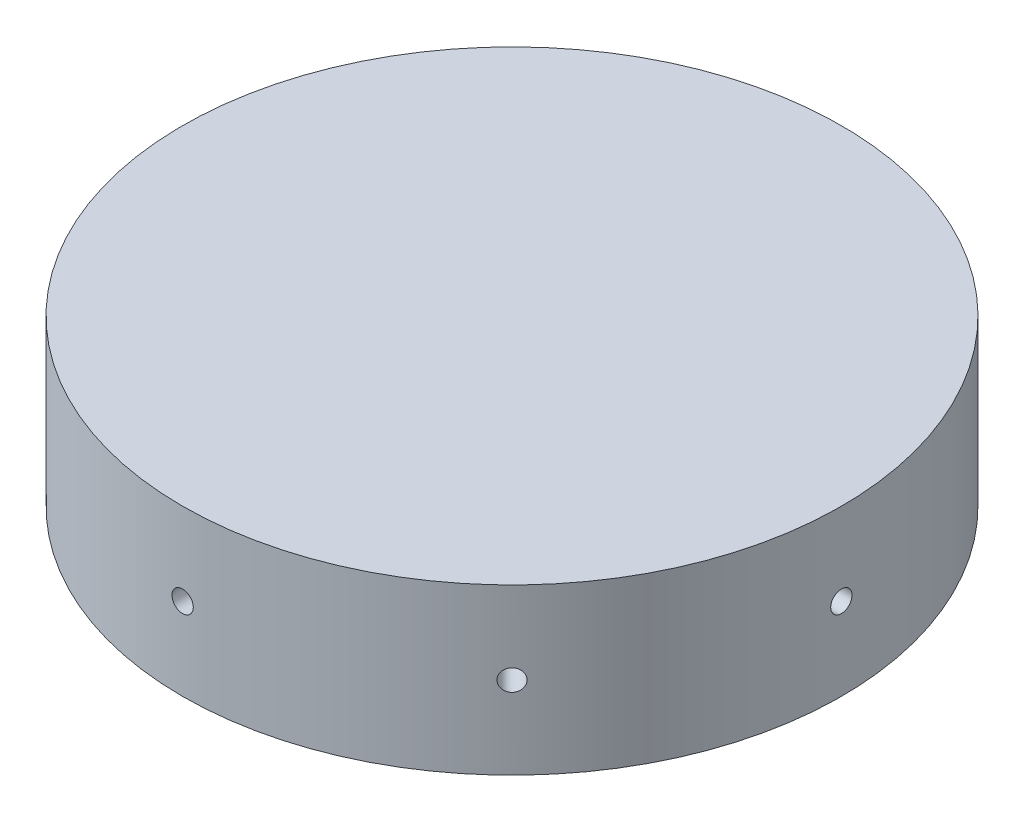
from build123d import *

# Parameters (mm, degrees)
SKETCH1_R                = 50.8
BULKHEAD_EXTRUSION_DEPTH = 25.4
SKETCH2_R                = 1.6383
SCREW_HOLE_DEPTH         = 12.7
CIRPATTERN1_COUNT        = 8


with BuildPart() as part:
    # Sketch1 → Bulkhead Extrusion (new body)
    with BuildSketch(Plane(origin=(0, 0, 0), x_dir=(1, 0, 0), z_dir=(0, 1, 0))):
        with Locations(Location((0, 0, 0), (0, 0, 270))):
            Circle(SKETCH1_R)
    extrude(amount=BULKHEAD_EXTRUSION_DEPTH)

    # Sketch2 → Screw Hole (cut)
    with BuildSketch(Plane.XY.offset(50.8)):
        with Locations((0, 12.7)):
            Circle(SKETCH2_R)
    screw_hole = extrude(amount=-SCREW_HOLE_DEPTH, mode=Mode.SUBTRACT)

    # CirPattern1: Screw Hole ×8 about axis
    cirpattern1_axis = Axis((0, 0, 0), (0, 1, 0))
    for i in range(1, CIRPATTERN1_COUNT):
        add(screw_hole.rotate(cirpattern1_axis, i * 360 / CIRPATTERN1_COUNT), mode=Mode.SUBTRACT)


solid = part.part
